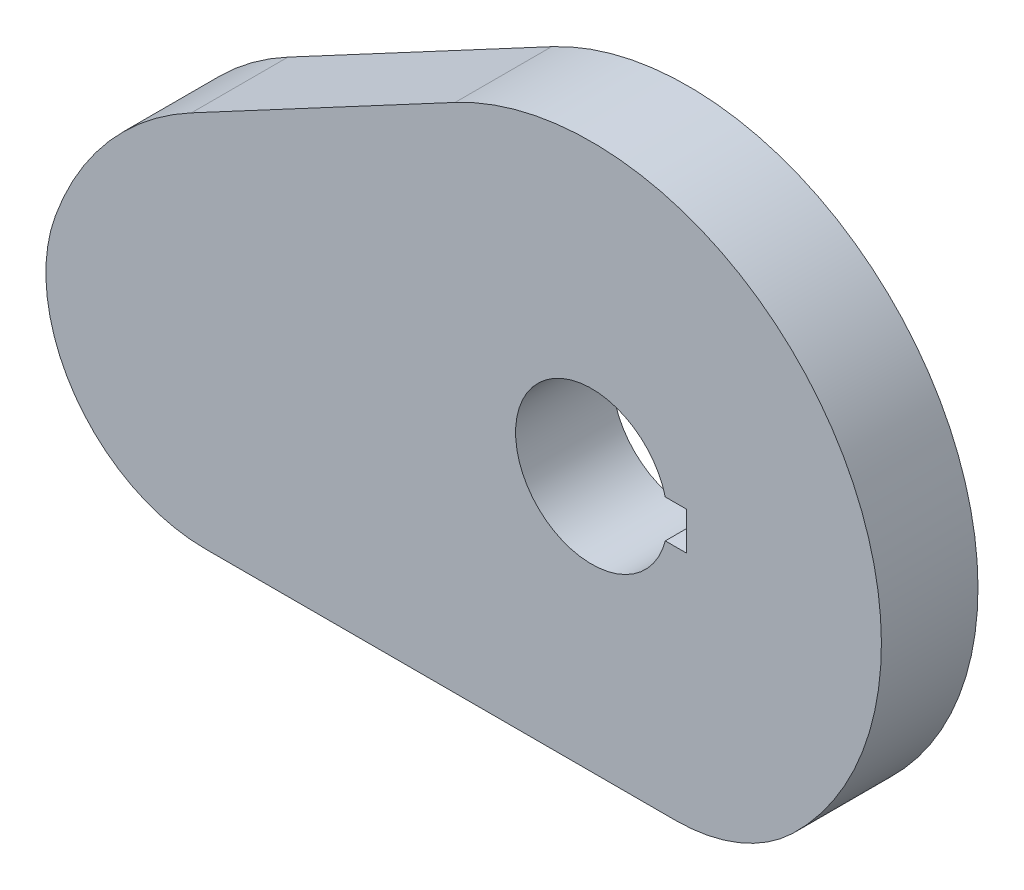
from build123d import *

# Parameters (mm, degrees)
EXTRUDE1_DEPTH = 12.7


with BuildPart() as part:
    # Sketch1 → Extrude1 (new, symmetric)
    with BuildSketch(Plane.XY):
        with BuildLine():
            Line((-105.256684146, 30.159371772), (-35.906883315, 67.209640161))
            ThreePointArc((-35.906883315, 67.209640161), (-31.500545183, 69.384116721), (-26.963222432, 71.270082335))
            ThreePointArc((-26.963222432, 71.270082335), (64.384642533, 40.75607692), (52.880823594, -54.864))
            ThreePointArc((52.880823594, -54.864), (38.665343582, -64.081234212), (22.033676498, -67.31))
            Line((22.033676498, -67.31), (-101.6, -67.31))
            ThreePointArc((-101.6, -67.31), (-135.901703173, -49.47989326), (-141.016910096, -11.160783079))
            ThreePointArc((-141.016910096, -11.160783079), (-126.968198666, 12.815152805), (-105.256684146, 30.159371772))
        make_face()
        with BuildLine():
            Line((19.364916731, 5), (25, 5))
            Line((25, 5), (25, -5))
            Line((25, -5), (19.364916731, -5))
            ThreePointArc((19.364916731, -5), (-20, 0), (19.364916731, 5))
        make_face(mode=Mode.SUBTRACT)
    extrude(amount=EXTRUDE1_DEPTH, both=True)


solid = part.part
